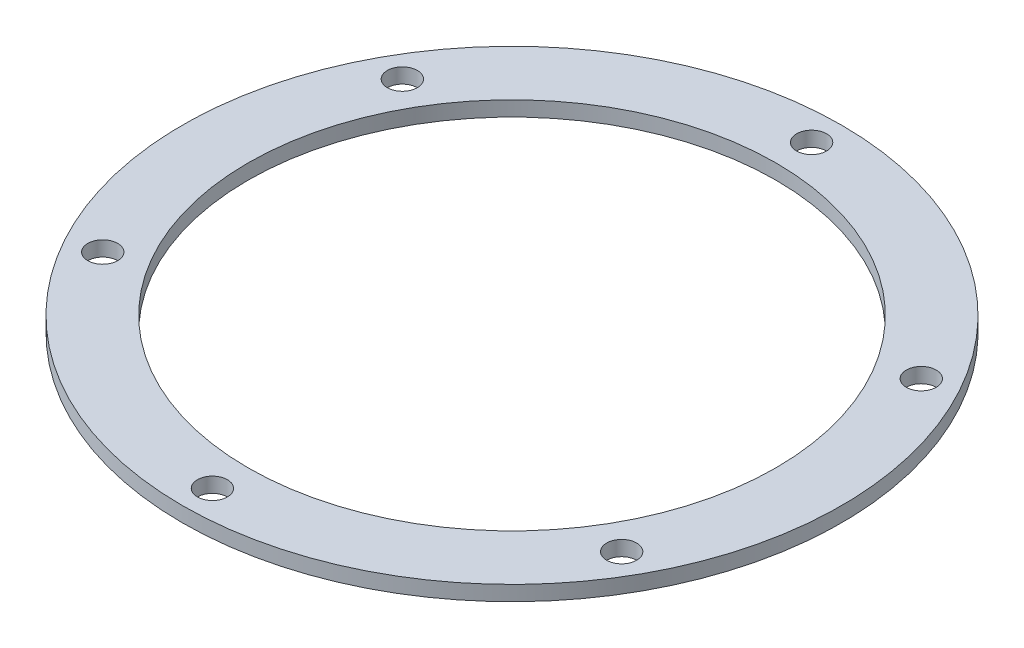
from build123d import *

# Parameters (mm, degrees)
SKETCH1_R           = 44
SKETCH1_R_2         = 35.25
SKETCH1_R_3         = 2
BOSS_EXTRUDE1_DEPTH = 2


with BuildPart() as part:
    # Sketch1 → Boss-Extrude1 (new body)
    with BuildSketch(Plane(origin=(0, 0, 0), x_dir=(1, 0, 0), z_dir=(0, 1, 0))):
        with Locations(Location((0, 0, 0), (0, 0, 270))):
            Circle(SKETCH1_R)
        with Locations(Location((0, 0, 0), (0, 0, 270))):
            Circle(SKETCH1_R_2, mode=Mode.SUBTRACT)
        with Locations(Location((0, 40, 0), (0, 0, 270))):
            Circle(SKETCH1_R_3, mode=Mode.SUBTRACT)
        with Locations(Location((34.641016151, 20, 0), (0, 0, 270))):
            Circle(SKETCH1_R_3, mode=Mode.SUBTRACT)
        with Locations(Location((34.641016151, -20, 0), (0, 0, 270))):
            Circle(SKETCH1_R_3, mode=Mode.SUBTRACT)
        with Locations(Location((0, -40, 0), (0, 0, 270))):
            Circle(SKETCH1_R_3, mode=Mode.SUBTRACT)
        with Locations(Location((-34.641016151, -20, 0), (0, 0, 270))):
            Circle(SKETCH1_R_3, mode=Mode.SUBTRACT)
        with Locations(Location((-34.641016151, 20, 0), (0, 0, 270))):
            Circle(SKETCH1_R_3, mode=Mode.SUBTRACT)
    extrude(amount=BOSS_EXTRUDE1_DEPTH)


solid = part.part
